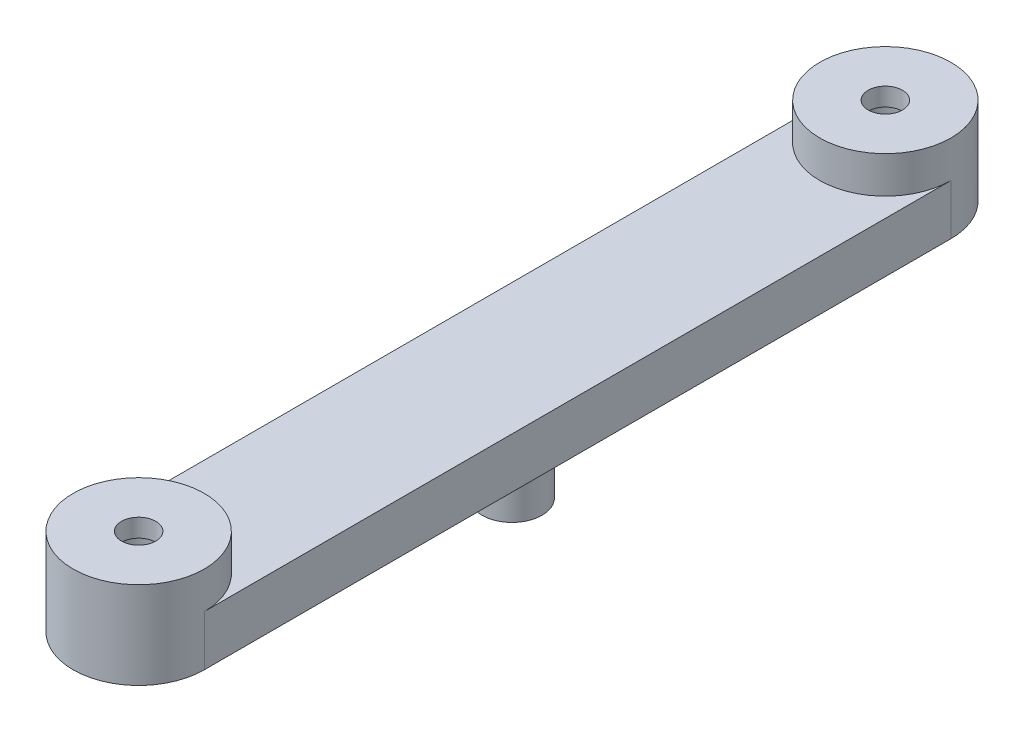
from build123d import *

# Parameters (mm, degrees)
BARRA_START       = -44.75
SK_BARRA_W        = 13
SK_BARRA_H        = 74
BARRA_DEPTH       = 5
EXTREMOS_START    = -44.75
SK_EXTREMOS_R     = 6.5
EXTREMOS_DEPTH    = 8.65
PERNO_696_START   = -51.75
SK_PERNO_696_R    = 2.975
PERNO_696_DEPTH   = 7
PASANTES_M3_START = -44.75
SK_PASANTES_M3_R  = 1.7
PASANTES_M3_DEPTH = 8.65
CAJAS_M3_START    = -44.75
SK_CAJAS_M3_R     = 3
CAJAS_M3_DEPTH    = 6.85


with BuildPart() as part:
    # Sk_Barra → Barra (new body)
    with BuildSketch(Plane(origin=(0, 0, 0), x_dir=(1, 0, 0), z_dir=(0, 1, 0)).offset(BARRA_START)):
        with Locations((0, -170)):
            Rectangle(SK_BARRA_W, SK_BARRA_H)
    extrude(amount=BARRA_DEPTH)

    # Sk_Extremos → Extremos (add)
    with BuildSketch(Plane(origin=(0, 0, 0), x_dir=(1, 0, 0), z_dir=(0, 1, 0)).offset(EXTREMOS_START)):
        with Locations((0, -133)):
            Circle(SK_EXTREMOS_R)
        with Locations((0, -207)):
            Circle(SK_EXTREMOS_R)
    extrude(amount=EXTREMOS_DEPTH)

    # Sk_Perno_696 → Perno_696 (add)
    with BuildSketch(Plane(origin=(0, 0, 0), x_dir=(1, 0, 0), z_dir=(0, 1, 0)).offset(PERNO_696_START)):
        with Locations(Location((0, -170, 0), (0, 0, 270))):
            Circle(SK_PERNO_696_R)
    extrude(amount=PERNO_696_DEPTH)

    # Sk_Pasantes_M3 → Pasantes_M3 (cut)
    with BuildSketch(Plane(origin=(0, 0, 0), x_dir=(1, 0, 0), z_dir=(0, 1, 0)).offset(PASANTES_M3_START)):
        with Locations(Location((0, -133, 0), (0, 0, 270))):
            Circle(SK_PASANTES_M3_R)
        with Locations(Location((0, -207, 0), (0, 0, 270))):
            Circle(SK_PASANTES_M3_R)
    extrude(amount=PASANTES_M3_DEPTH, mode=Mode.SUBTRACT)

    # Sk_Cajas_M3 → Cajas_M3 (cut)
    with BuildSketch(Plane(origin=(0, 0, 0), x_dir=(1, 0, 0), z_dir=(0, 1, 0)).offset(CAJAS_M3_START)):
        with Locations(Location((0, -133, 0), (0, 0, 90))):
            Circle(SK_CAJAS_M3_R)
        with Locations(Location((0, -207, 0), (0, 0, 90))):
            Circle(SK_CAJAS_M3_R)
    extrude(amount=CAJAS_M3_DEPTH, mode=Mode.SUBTRACT)


solid = part.part
